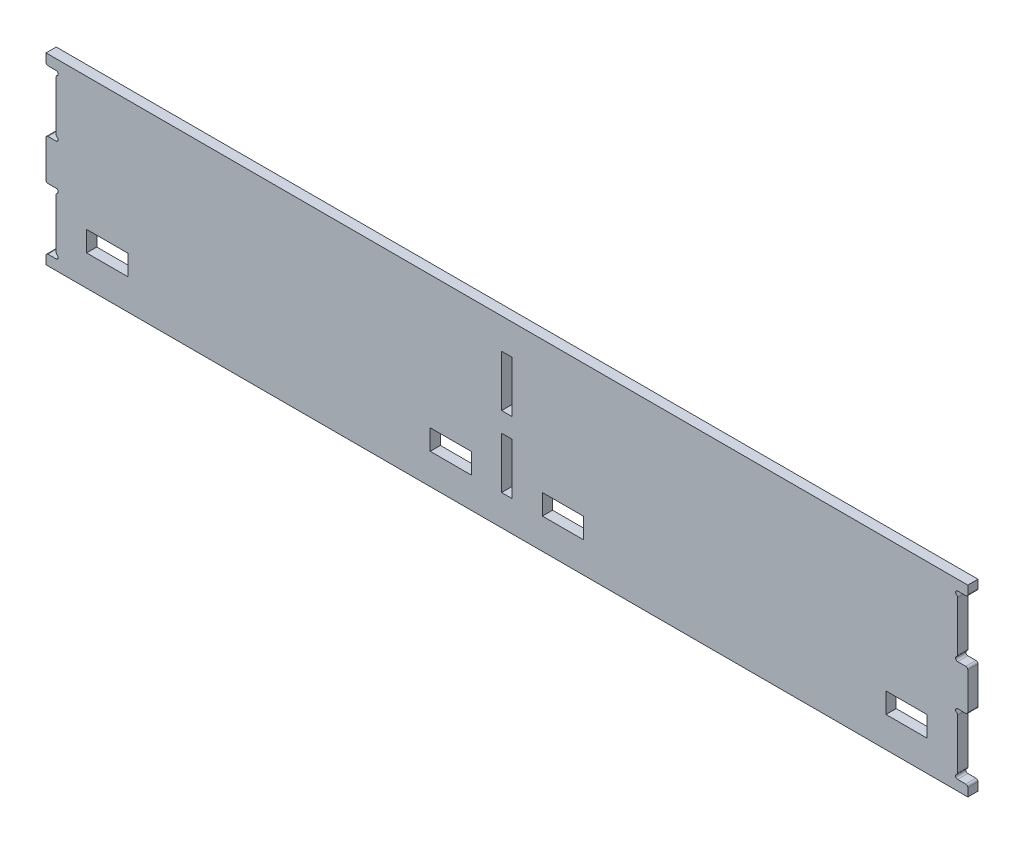
from build123d import *

# Parameters (mm, degrees)
SKETCH1_W           = 452
SKETCH1_H           = 90
BOSS_EXTRUDE1_DEPTH = 5
SKETCH2_W           = 5.2
SKETCH2_H           = 25.2
CUT_EXTRUDE1_DEPTH  = 231.490780727
SKETCH4_W           = 5
SKETCH4_H           = 30
CUT_EXTRUDE5_DEPTH  = 5
SKETCH7_R           = 1
CUT_EXTRUDE6_DEPTH  = 231.490780727
FILLET4_R           = 1
SKETCH8_W           = 20.2
SKETCH8_H           = 10
CUT_EXTRUDE7_DEPTH  = 10
SKETCH9_W           = 20.2
SKETCH9_H           = 10
CUT_EXTRUDE8_DEPTH  = 300


with BuildPart() as part:
    # Sketch1 → Boss-Extrude1 (new body)
    with BuildSketch(Plane.XY):
        Rectangle(SKETCH1_W, SKETCH1_H)
    extrude(amount=BOSS_EXTRUDE1_DEPTH)

    # Sketch2 → Cut-Extrude1 (cut, through all)
    with BuildSketch(Plane.XY.offset(5)):
        with Locations((0, 17.4)):
            Rectangle(SKETCH2_W, SKETCH2_H)
        with Locations((0, -17.4)):
            Rectangle(SKETCH2_W, SKETCH2_H)
    extrude(amount=-CUT_EXTRUDE1_DEPTH, mode=Mode.SUBTRACT)

    # Sketch4 → Cut-Extrude5 (cut)
    with BuildSketch(Plane.ZY.offset(226)):
        with Locations((2.5, 25)):
            Rectangle(SKETCH4_W, SKETCH4_H)
        with Locations((2.5, -25)):
            Rectangle(SKETCH4_W, SKETCH4_H)
    cut_extrude5 = extrude(amount=-CUT_EXTRUDE5_DEPTH, mode=Mode.SUBTRACT)

    # Mirror2: Cut-Extrude5 across plane
    add(cut_extrude5.mirror(Plane(origin=(0, 0, 0), x_dir=(0, 0, 1), z_dir=(1, 0, 0))), mode=Mode.SUBTRACT)

    # Sketch7 → Cut-Extrude6 (cut, through all)
    with BuildSketch(Plane.XY.offset(5)):
        with Locations((-221, 39)):
            Circle(SKETCH7_R)
        with Locations((-221, 11)):
            Circle(SKETCH7_R)
        with Locations((-221, -11)):
            Circle(SKETCH7_R)
        with Locations((-221, -39)):
            Circle(SKETCH7_R)
        with Locations((221, -39)):
            Circle(SKETCH7_R)
        with Locations((221, -11)):
            Circle(SKETCH7_R)
        with Locations((221, 11)):
            Circle(SKETCH7_R)
        with Locations((221, 39)):
            Circle(SKETCH7_R)
    extrude(amount=-CUT_EXTRUDE6_DEPTH, mode=Mode.SUBTRACT)

    # Fillet4
    fillet4_edges = [part.edges().sort_by_distance(p)[0] for p in [
        (221, 38, 2.5),
        (221, 12, 2.5),
        (221, -12, 2.5),
        (221, -38, 2.5),
        (-221, 38, 2.5),
        (-221, 12, 2.5),
        (-221, -38, 2.5),
        (-221, -12, 2.5),
        (-226, 10, 2.5),
        (-226, 40, 2.5),
        (-226, -40, 2.5),
        (-226, -10, 2.5),
        (226, 10, 2.5),
        (226, 40, 2.5),
        (226, -40, 2.5),
        (226, -10, 2.5),
    ]]
    fillet(fillet4_edges, radius=FILLET4_R)

    # Sketch8 → Cut-Extrude7 (cut)
    with BuildSketch(Plane(origin=(0, -610.456150304, 0), x_dir=(-1, 0, 0), z_dir=(0, 0, -1))):
        with Locations((-196, 585.456150304)):
            Rectangle(SKETCH8_W, SKETCH8_H)
    cut_extrude7 = extrude(amount=-CUT_EXTRUDE7_DEPTH, mode=Mode.SUBTRACT)

    # Mirror3: Cut-Extrude7 across plane
    add(cut_extrude7.mirror(Plane(origin=(0, 0, 0), x_dir=(0, 0, 1), z_dir=(1, 0, 0))), mode=Mode.SUBTRACT)

    # Sketch9 → Cut-Extrude8 (cut)
    with BuildSketch(Plane(origin=(0, -610.456150304, -223.6), x_dir=(-1, 0, 0), z_dir=(0, 0, -1))):
        with Locations((27.5, 585.456150304)):
            Rectangle(SKETCH9_W, SKETCH9_H)
    cut_extrude8 = extrude(amount=-CUT_EXTRUDE8_DEPTH, mode=Mode.SUBTRACT)

    # Mirror4: Cut-Extrude8 across plane
    add(cut_extrude8.mirror(Plane(origin=(0, 0, 0), x_dir=(0, 0, 1), z_dir=(1, 0, 0))), mode=Mode.SUBTRACT)


solid = part.part
